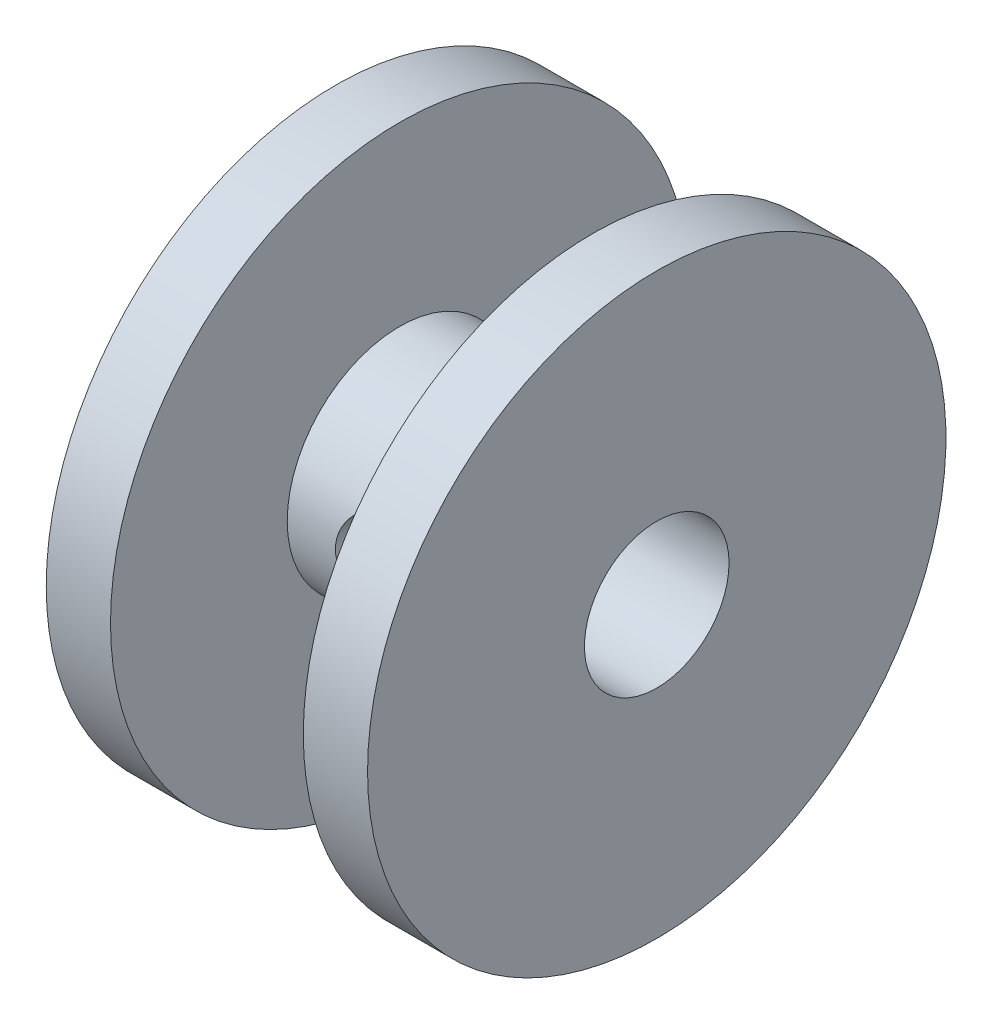
from build123d import *

# Parameters (mm, degrees)
SKETCH2_R               = 2.25
CUT_EXTRUDE1_DEPTH      = 32.295394302
CUT_EXTRUDE2_DEPTH      = 91.152948551
CUT_EXTRUDE2_DEPTH_BACK = 91.152948551
SKETCH5_R               = 1.5


with BuildPart() as part:
    # Sketch1 → Revolve2 (revolve)
    with BuildSketch(Plane.XY, mode=Mode.PRIVATE) as revolve2_sk:
        Polygon((-85.136081821, -10.256002982), (-85.136081821, -19.256002982), (-75.136081821, -19.256002982), (-75.136081821, -10.256002982), (-77.136081821, -10.256002982), (-77.136081821, -15.756002982), (-83.136081821, -15.756002982), (-83.136081821, -10.256002982), align=None)
    revolve(revolve2_sk.sketch.rotate(Axis((-85.136081821, -19.256002982, 0), (1, 0, 0)), 90), axis=Axis((-85.136081821, -19.256002982, 0), (1, 0, 0)))

    # Sketch2 → Cut-Extrude1 (cut, through all)
    with BuildSketch(Plane(origin=(-75.136081821, 0, 0), x_dir=(0, 0, -1), z_dir=(1, 0, 0))):
        with Locations((0, -19.256002982)):
            Circle(SKETCH2_R)
    extrude(amount=-CUT_EXTRUDE1_DEPTH, mode=Mode.SUBTRACT)

    # Sketch5 → Cut-Extrude2 (cut, two sides: drawn at the far end of the back side and taken through both)
    with BuildSketch(Plane.XY.offset(-CUT_EXTRUDE2_DEPTH_BACK)):
        with Locations((-80.136081821, -19.256002982)):
            Circle(SKETCH5_R)
    extrude(amount=CUT_EXTRUDE2_DEPTH + CUT_EXTRUDE2_DEPTH_BACK, mode=Mode.SUBTRACT)


solid = part.part
